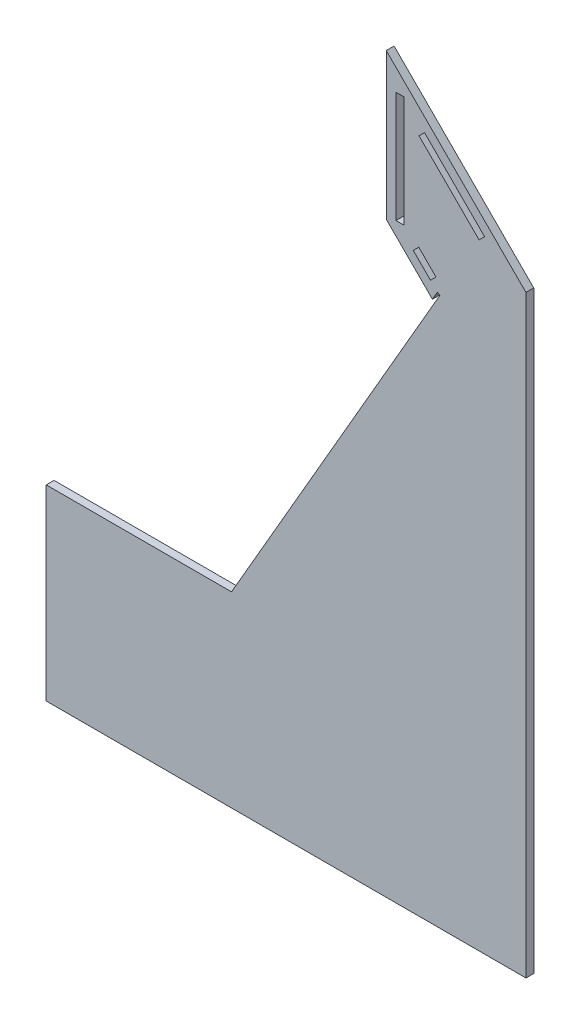
from build123d import *

# Parameters (mm, degrees)
SKETCH1_W           = 8
SKETCH1_H           = 113.93
BOSS_EXTRUDE1_DEPTH = 8


with BuildPart() as part:
    # Sketch1 → Boss-Extrude1 (new body)
    with BuildSketch(Plane.XY):
        Polygon((0, 192), (0, 0), (492, 0), (492, 608.949580676), (348.752525317, 752.197055359), (348.752525317, 602.197055359), (396.053847577, 554.895733099), (401.154700619, 563.730669729), (403.75277683, 562.230669729), (398.25, 552.699580676), (190, 192), align=None)
        with Locations((362.728293748, 663.1220766)):
            Rectangle(SKETCH1_W, SKETCH1_H, mode=Mode.SUBTRACT)
        Polygon((394.083632807, 570.801737541), (376.405963277, 588.479407071), (382.062817527, 594.13626132), (399.740487057, 576.458591791), align=None, mode=Mode.SUBTRACT)
        Polygon((443.916069982, 631.585591867), (382.284642934, 693.217018915), (387.941497183, 698.873873165), (449.572924232, 637.242446117), align=None, mode=Mode.SUBTRACT)
    extrude(amount=BOSS_EXTRUDE1_DEPTH)


solid = part.part
